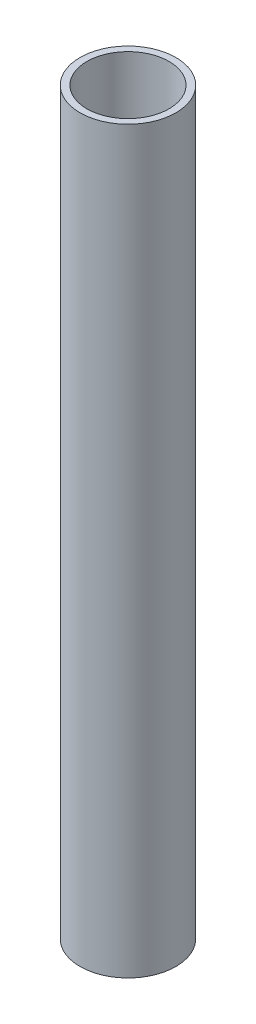
from build123d import *

# Parameters (mm, degrees)
SKETCH1_R           = 3.5
SKETCH1_R_2         = 3
BOSS_EXTRUDE1_DEPTH = 54


with BuildPart() as part:
    # Sketch1 → Boss-Extrude1 (new body)
    with BuildSketch(Plane(origin=(0, 0, 0), x_dir=(1, 0, 0), z_dir=(0, 1, 0))):
        with Locations(Location((0, 0, 0), (0, 0, 270))):
            Circle(SKETCH1_R)
        with Locations(Location((0, 0, 0), (0, 0, 270))):
            Circle(SKETCH1_R_2, mode=Mode.SUBTRACT)
    extrude(amount=BOSS_EXTRUDE1_DEPTH)


solid = part.part
